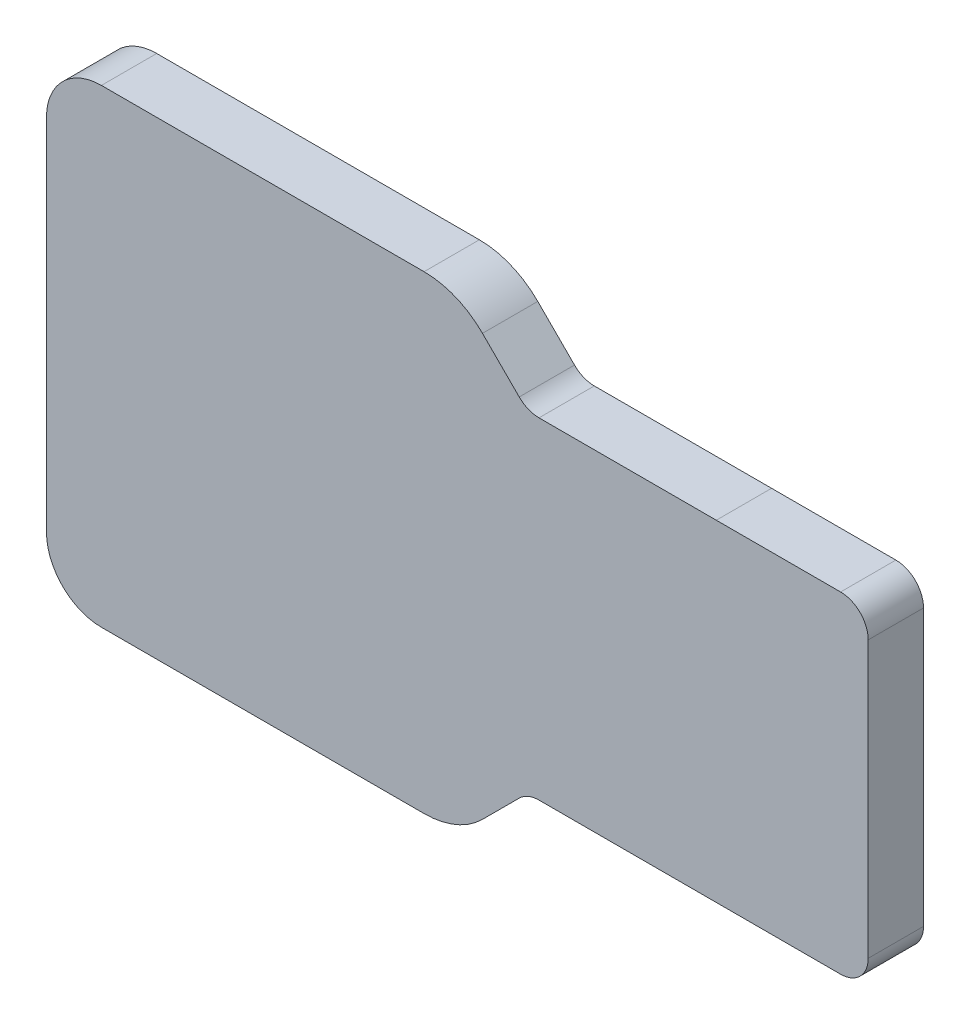
from build123d import *

# Parameters (mm, degrees)
EXTRUDE_1_DEPTH = 1
EXTRUDE_START   = 1
EXTRUDE_2_DEPTH = 1
EXTRUDE_3_DEPTH = 2
FILLET_1_R      = 1


with BuildPart() as part:
    # 草图1 → 凸台-拉伸1 (new body)
    with BuildSketch(Plane.XY):
        with BuildLine():
            ThreePointArc((-11.921595121, -5.987310135), (-12.309141559, -6.064397915), (-12.637687565, -6.283925339))
            Line((-12.637687565, -6.283925339), (-13.9661153, -7.612353074))
            ThreePointArc((-13.9661153, -7.612353074), (-14.935267633, -8.259919962), (-16.078460757, -8.487315215))
            Line((-16.078460757, -8.487315215), (-27.75005588, -8.487315215))
            ThreePointArc((-27.75005588, -8.487315215), (-29.155290964, -7.905247784), (-29.737358395, -6.5000127))
            Line((-29.737358395, -6.5000127), (-29.737358395, 6.5000127))
            ThreePointArc((-29.737358395, 6.5000127), (-29.155290964, 7.905247784), (-27.75005588, 8.487315215))
            Line((-27.75005588, 8.487315215), (-16.078460755, 8.487315215))
            ThreePointArc((-16.078460755, 8.487315215), (-14.935267633, 8.259919962), (-13.966115301, 7.612353076))
            Line((-13.966115301, 7.612353076), (-12.637687563, 6.283925337))
            ThreePointArc((-12.637687563, 6.283925337), (-12.309141741, 6.06439799), (-11.921595517, 5.987310135))
            Line((-11.921595517, 5.987310135), (-5.508963215, 5.987312659))
            Line((-5.508963215, 5.987312659), (-2.49105204, 5.987310135))
            Line((-2.49105204, 5.987310135), (-2.00000508, 5.987310135))
            Line((-2.00000508, 5.987310135), (-0.012702565, 5.987310135))
            Line((-0.012702565, 5.987310135), (-0.012702565, 4.00000762))
            Line((-0.012702565, 4.00000762), (-0.012702565, -4.00000762))
            Line((-0.012702565, -4.00000762), (-0.012702565, -5.987310135))
            Line((-0.012702565, -5.987310135), (-2.00000508, -5.987310135))
            Line((-2.00000508, -5.987310135), (-2.49105458, -5.987310135))
            Line((-2.49105458, -5.987310135), (-5.5089632, -5.987310135))
            Line((-5.5089632, -5.987310135), (-11.921595121, -5.987310135))
        make_face()
    extrude(amount=EXTRUDE_1_DEPTH)

    # 草图2 → 凸台-拉伸2 (add)
    with BuildSketch(Plane(origin=(0, 0, 0), x_dir=(-1, 0, 0), z_dir=(0, 0, -1)).offset(EXTRUDE_START)):
        with BuildLine():
            Line((0.012702565, -5.987310135), (11.921595121, -5.987310135))
            ThreePointArc((11.921595121, -5.987310135), (12.309141559, -6.064397915), (12.637687565, -6.283925339))
            Line((12.637687565, -6.283925339), (13.9661153, -7.612353074))
            ThreePointArc((13.9661153, -7.612353074), (14.935267633, -8.259919962), (16.078460757, -8.487315215))
            Line((16.078460757, -8.487315215), (27.75005588, -8.487315215))
            ThreePointArc((27.75005588, -8.487315215), (29.155290964, -7.905247784), (29.737358395, -6.5000127))
            Line((29.737358395, -6.5000127), (29.737358395, 6.5000127))
            ThreePointArc((29.737358395, 6.5000127), (29.155290964, 7.905247784), (27.75005588, 8.487315215))
            Line((27.75005588, 8.487315215), (16.078460755, 8.487315215))
            ThreePointArc((16.078460755, 8.487315215), (14.935267633, 8.259919962), (13.966115301, 7.612353076))
            Line((13.966115301, 7.612353076), (12.637687563, 6.283925337))
            ThreePointArc((12.637687563, 6.283925337), (12.309141741, 6.06439799), (11.921595517, 5.987310135))
            Line((11.921595517, 5.987310135), (5.508963215, 5.987312659))
            Line((5.508963215, 5.987312659), (2.49105204, 5.987310135))
            Line((2.49105204, 5.987310135), (0.012702565, 5.987310135))
            Line((0.012702565, 5.987310135), (0.012702565, -5.987310135))
        make_face()
        with BuildLine():
            Line((0.912702565, -4.00000762), (0.912702565, 4.00000762))
            ThreePointArc((0.912702565, 4.00000762), (1.231166099, 4.768846601), (2.00000508, 5.087310135))
            Line((2.00000508, 5.087310135), (2.692900097, 5.087310135))
            ThreePointArc((2.692900097, 5.087310135), (2.850834155, 5.118726257), (2.984723794, 5.208189682))
            Line((2.984723794, 5.208189682), (3.291830699, 5.515296587))
            ThreePointArc((3.291830699, 5.515296587), (3.482364562, 5.642607176), (3.707114551, 5.687312675))
            Line((3.707114551, 5.687312675), (4.292903203, 5.687312675))
            ThreePointArc((4.292903203, 5.687312675), (4.517653218, 5.642607176), (4.708187099, 5.515296569))
            Line((4.708187099, 5.515296569), (5.015294015, 5.208189653))
            ThreePointArc((5.015294015, 5.208189653), (5.149076381, 5.118771977), (5.306884994, 5.087312733))
            Line((5.306884994, 5.087312733), (11.921595123, 5.087310135))
            ThreePointArc((11.921595123, 5.087310135), (12.653556649, 5.232906336), (13.274083668, 5.647529236))
            Line((13.274083668, 5.647529236), (14.602511404, 6.975956972))
            ThreePointArc((14.602511404, 6.975956972), (15.279682723, 7.428428383), (16.078460757, 7.587315215))
            Line((16.078460757, 7.587315215), (27.75005588, 7.587315215))
            ThreePointArc((27.75005588, 7.587315215), (28.518894861, 7.268851681), (28.837358395, 6.5000127))
            Line((28.837358395, 6.5000127), (28.837358395, -6.5000127))
            ThreePointArc((28.837358395, -6.5000127), (28.518894861, -7.268851681), (27.75005588, -7.587315215))
            Line((27.75005588, -7.587315215), (16.078460757, -7.587315215))
            ThreePointArc((16.078460757, -7.587315215), (15.279682723, -7.428428383), (14.602511404, -6.975956973))
            Line((14.602511404, -6.975956973), (13.274083667, -5.647529236))
            ThreePointArc((13.274083667, -5.647529236), (12.653556649, -5.232906336), (11.921595123, -5.087310135))
            Line((11.921595123, -5.087310135), (5.307117071, -5.087310135))
            ThreePointArc((5.307117071, -5.087310135), (5.149183592, -5.118725011), (5.015294034, -5.208187095))
            Line((5.015294034, -5.208187095), (4.708187081, -5.515294047))
            ThreePointArc((4.708187081, -5.515294047), (4.517653218, -5.642604636), (4.292903229, -5.687310135))
            Line((4.292903229, -5.687310135), (3.707114577, -5.687310135))
            ThreePointArc((3.707114577, -5.687310135), (3.482364562, -5.642604636), (3.291830681, -5.515294029))
            Line((3.291830681, -5.515294029), (2.984723765, -5.208187113))
            ThreePointArc((2.984723765, -5.208187113), (2.850834188, -5.118725011), (2.692900682, -5.087310135))
            Line((2.692900682, -5.087310135), (2.00000508, -5.087310135))
            ThreePointArc((2.00000508, -5.087310135), (1.231166099, -4.768846601), (0.912702565, -4.00000762))
        make_face(mode=Mode.SUBTRACT)
    extrude(amount=-EXTRUDE_2_DEPTH)

    # 草图2<4> → 凸台-拉伸3 (add)
    with BuildSketch(Plane(origin=(0, 0, 0), x_dir=(-1, 0, 0), z_dir=(0, 0, -1))):
        with BuildLine():
            ThreePointArc((14.197426975, -5.123210566), (15.097429515, -6.023213106), (15.997432055, -5.123210566))
            ThreePointArc((15.997432055, -5.123210566), (15.097429515, -4.223208026), (14.197426975, -5.123210566))
        make_face()
    extrude(amount=EXTRUDE_3_DEPTH)

    # 圆角1
    fillet_1_edges = [part.edges().sort_by_distance(p)[0] for p in [
        (-0.012702565, 5.987310135, 0),
        (-0.012702565, -5.987310135, 0),
    ]]
    fillet(fillet_1_edges, radius=FILLET_1_R)


solid = part.part
